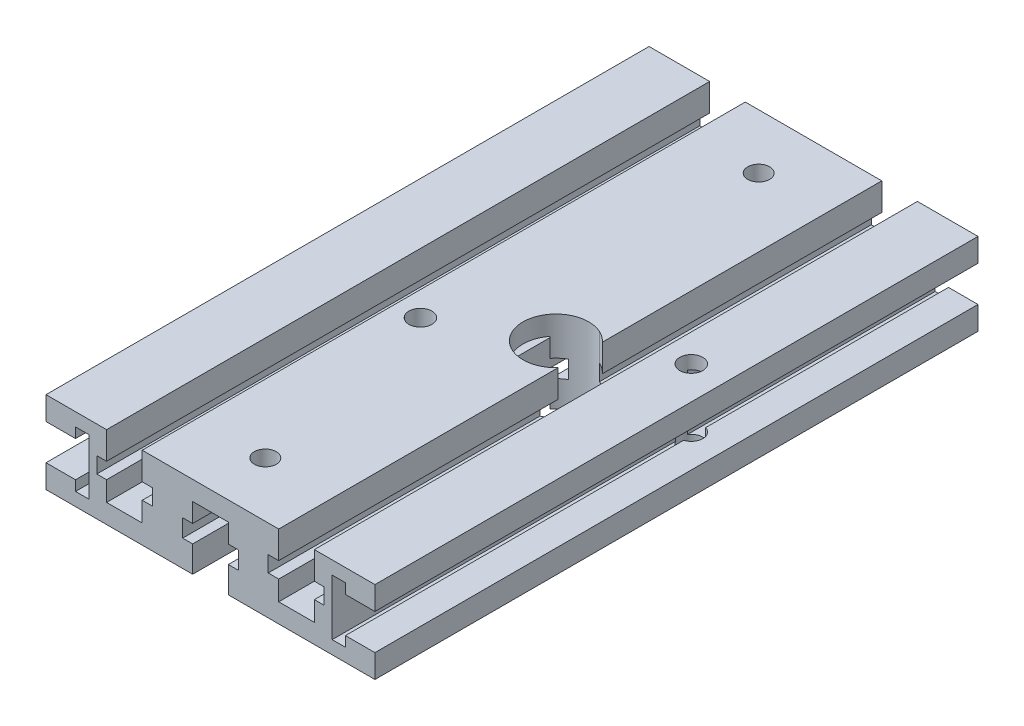
from build123d import *

# Parameters (mm, degrees)
EXTRUDE_1_DEPTH         = 110
HOLE_WIZARD_4_0_4_1_D   = 4
HOLE_WIZARD_12_0_12_1_D = 12
HOLE_WIZARD_M5_1_D      = 4.2


with BuildPart() as part:
    # 草图1 → 凸台-拉伸1 (new body)
    with BuildSketch(Plane.XY):
        Polygon((0, 0), (26.75, 0), (26.75, 4.796419132), (24.926505169, 4.796419132), (24.926505169, 8.023402897), (26.75, 8.023402897), (26.75, 11.5), (30, 11.5), (33.25, 11.5), (33.25, 8.023402897), (35.073494831, 8.023402897), (35.073494831, 4.796419132), (33.25, 4.796419132), (33.25, 0), (60, 0), (60, 4.25), (54.613325713, 4.25), (54.613325713, 2.4), (52.2, 2.4), (52.2, 12.6), (54.613325713, 12.6), (54.613325713, 10.75), (60, 10.75), (60, 15), (48.947608979, 15), (48.947608979, 10.003848618), (50.733802833, 10.003848618), (50.733802833, 7.094693738), (48.947608979, 7.094693738), (48.947608979, 3.5), (42.447608979, 3.5), (42.447608979, 7.094693738), (40.533802833, 7.094693738), (40.533802833, 10.003848618), (42.447608979, 10.003848618), (42.447608979, 15), (30, 15), (17.552391021, 15), (17.552391021, 10.003848618), (19.466197167, 10.003848618), (19.466197167, 7.094693738), (17.552391021, 7.094693738), (17.552391021, 3.5), (11.052391021, 3.5), (11.052391021, 7.094693738), (9.266197167, 7.094693738), (9.266197167, 10.003848618), (11.052391021, 10.003848618), (11.052391021, 15), (0, 15), (0, 10.75), (5.386674287, 10.75), (5.386674287, 12.6), (7.8, 12.6), (7.8, 2.4), (5.386674287, 2.4), (5.386674287, 4.25), (0, 4.25), align=None)
    extrude(amount=EXTRUDE_1_DEPTH)

    # Ø4.0 (4) 直径孔1 (through all)
    with Locations(Plane(origin=(0, 11.5, 0), x_dir=(-1, 0, 0), z_dir=(0, -1, 0))):
        with Locations((-30, -100), (-30, -10)):
            Hole(HOLE_WIZARD_4_0_4_1_D / 2)

    # Ø12.0 (12) 直径孔1 (through all)
    with Locations(Plane(origin=(0, 0, 0), x_dir=(-1, 0, 0), z_dir=(0, -1, 0))):
        with Locations((-38, -55)):
            Hole(HOLE_WIZARD_12_0_12_1_D / 2)

    # M5 螺纹孔1 (through all)
    with Locations(Plane(origin=(0, 0, 0), x_dir=(-1, 0, 0), z_dir=(0, -1, 0))):
        with Locations((-54, -46.3), (-22, -63.7)):
            Hole(HOLE_WIZARD_M5_1_D / 2)


solid = part.part
